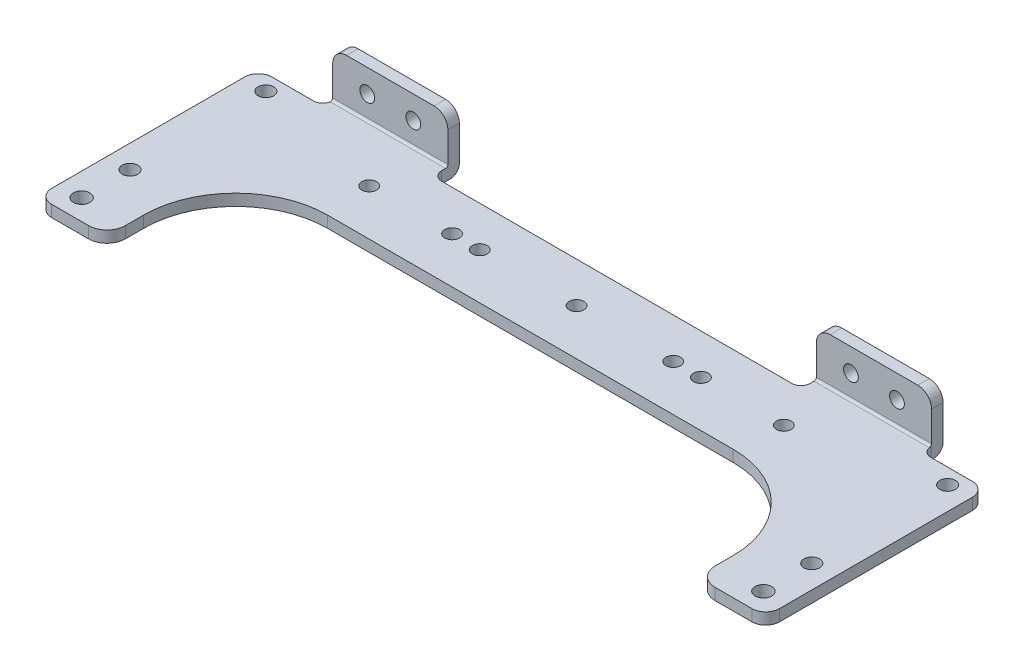
from build123d import *

# Parameters (mm, degrees)
SKETCH_1_W                      = 158
SKETCH_1_H                      = 47.848101266
EXTRUDE_1_DEPTH                 = 2.5
CUT_EXTRUDE_1_REACH             = 84.581
SKETCH_2_W                      = 64
SKETCH_2_H                      = 27.924050633
CUT_EXTRUDE_2_REACH             = 84.581
SKETCH_4_R                      = 1.7
SKETCH_4_R_2                    = 1.8
CUT_EXTRUDE_3_REACH             = 84.581
SKETCH_5_R                      = 1.6
CUT_EXTRUDE_3_DIRECTION_2_DEPTH = 83.580931205
FILLET_4_R                      = 3
FILLET_5_R                      = 4
FILLET_6_R                      = 20
EXTRUDE_START                   = -79
EXTRUDE_2_DEPTH                 = 65
CUT_EXTRUDE_START               = -79
CUT_EXTRUDE_4_DEPTH             = 40
FILLET_7_R                      = 0.5
FILLET_8_R                      = 2
FILLET_9_R                      = 3
FILLET_10_R                     = 2
SKETCH_10_R                     = 1.6
CUT_EXTRUDE_5_DEPTH             = 95.325235224
SKETCH_11_R                     = 1.6
CUT_EXTRUDE_6_DEPTH             = 85.602511087


with BuildPart() as part:
    # 草图1 → 凸台-拉伸1 (new body)
    with BuildSketch(Plane(origin=(0, 0, 0), x_dir=(1, 0, 0), z_dir=(0, 1, 0))):
        Rectangle(SKETCH_1_W, SKETCH_1_H)
    extrude(amount=EXTRUDE_1_DEPTH)

    # 草图2 → 切除-拉伸1 (cut, up to next)
    with BuildSketch(Plane(origin=(0, 2.5, 0), x_dir=(1, 0, 0), z_dir=(0, 1, 0)), mode=Mode.PRIVATE) as cut_extrude_1_sk1:
        with Locations((-32, -9.962025317)):
            Rectangle(SKETCH_2_W, SKETCH_2_H)
    cut_extrude_1_tool1 = extrude(cut_extrude_1_sk1.sketch, amount=-CUT_EXTRUDE_1_REACH, mode=Mode.PRIVATE) & part.part
    # 草图2 → 切除-拉伸1 (cut, up to next)
    with BuildSketch(Plane(origin=(0, 2.5, 0), x_dir=(1, 0, 0), z_dir=(0, 1, 0)), mode=Mode.PRIVATE) as cut_extrude_1_sk2:
        with Locations((32, -9.962025317)):
            Rectangle(SKETCH_2_W, SKETCH_2_H)
    cut_extrude_1_tool2 = extrude(cut_extrude_1_sk2.sketch, amount=-CUT_EXTRUDE_1_REACH, mode=Mode.PRIVATE) & part.part
    add(cut_extrude_1_tool1.solids().sort_by_distance((-32, 2.5, 9.962025))[0], mode=Mode.SUBTRACT)
    add(cut_extrude_1_tool2.solids().sort_by_distance((32, 2.5, 9.962025))[0], mode=Mode.SUBTRACT)

    # 草图4 → 切除-拉伸2 (cut, up to next)
    with BuildSketch(Plane(origin=(0, 2.5, 0), x_dir=(1, 0, 0), z_dir=(0, 1, 0)), mode=Mode.PRIVATE) as cut_extrude_2_sk1:
        with Locations(Location((-74, -8.924050633, 0), (0, 0, 270))):
            Circle(SKETCH_4_R)
    cut_extrude_2_tool1 = extrude(cut_extrude_2_sk1.sketch, amount=-CUT_EXTRUDE_2_REACH, mode=Mode.PRIVATE) & part.part
    # 草图4 → 切除-拉伸2 (cut, up to next)
    with BuildSketch(Plane(origin=(0, 2.5, 0), x_dir=(1, 0, 0), z_dir=(0, 1, 0)), mode=Mode.PRIVATE) as cut_extrude_2_sk2:
        with Locations(Location((-74, 20.575949367, 0), (0, 0, 270))):
            Circle(SKETCH_4_R)
    cut_extrude_2_tool2 = extrude(cut_extrude_2_sk2.sketch, amount=-CUT_EXTRUDE_2_REACH, mode=Mode.PRIVATE) & part.part
    # 草图4 → 切除-拉伸2 (cut, up to next)
    with BuildSketch(Plane(origin=(0, 2.5, 0), x_dir=(1, 0, 0), z_dir=(0, 1, 0)), mode=Mode.PRIVATE) as cut_extrude_2_sk3:
        with Locations(Location((-74, -19.424050633, 0), (0, 0, 270))):
            Circle(SKETCH_4_R_2)
    cut_extrude_2_tool3 = extrude(cut_extrude_2_sk3.sketch, amount=-CUT_EXTRUDE_2_REACH, mode=Mode.PRIVATE) & part.part
    # 草图4 → 切除-拉伸2 (cut, up to next)
    with BuildSketch(Plane(origin=(0, 2.5, 0), x_dir=(1, 0, 0), z_dir=(0, 1, 0)), mode=Mode.PRIVATE) as cut_extrude_2_sk4:
        with Locations(Location((74, 20.575949367, 0), (0, 0, 270))):
            Circle(SKETCH_4_R)
    cut_extrude_2_tool4 = extrude(cut_extrude_2_sk4.sketch, amount=-CUT_EXTRUDE_2_REACH, mode=Mode.PRIVATE) & part.part
    # 草图4 → 切除-拉伸2 (cut, up to next)
    with BuildSketch(Plane(origin=(0, 2.5, 0), x_dir=(1, 0, 0), z_dir=(0, 1, 0)), mode=Mode.PRIVATE) as cut_extrude_2_sk5:
        with Locations(Location((74, -19.424050633, 0), (0, 0, 270))):
            Circle(SKETCH_4_R_2)
    cut_extrude_2_tool5 = extrude(cut_extrude_2_sk5.sketch, amount=-CUT_EXTRUDE_2_REACH, mode=Mode.PRIVATE) & part.part
    # 草图4 → 切除-拉伸2 (cut, up to next)
    with BuildSketch(Plane(origin=(0, 2.5, 0), x_dir=(1, 0, 0), z_dir=(0, 1, 0)), mode=Mode.PRIVATE) as cut_extrude_2_sk6:
        with Locations(Location((74, -8.924050633, 0), (0, 0, 270))):
            Circle(SKETCH_4_R)
    cut_extrude_2_tool6 = extrude(cut_extrude_2_sk6.sketch, amount=-CUT_EXTRUDE_2_REACH, mode=Mode.PRIVATE) & part.part
    add(cut_extrude_2_tool1.solids().sort_by_distance((-74, 2.5, 8.924051))[0], mode=Mode.SUBTRACT)
    add(cut_extrude_2_tool2.solids().sort_by_distance((-74, 2.5, -20.575949))[0], mode=Mode.SUBTRACT)
    add(cut_extrude_2_tool3.solids().sort_by_distance((-74, 2.5, 19.424051))[0], mode=Mode.SUBTRACT)
    add(cut_extrude_2_tool4.solids().sort_by_distance((74, 2.5, -20.575949))[0], mode=Mode.SUBTRACT)
    add(cut_extrude_2_tool5.solids().sort_by_distance((74, 2.5, 19.424051))[0], mode=Mode.SUBTRACT)
    add(cut_extrude_2_tool6.solids().sort_by_distance((74, 2.5, 8.924051))[0], mode=Mode.SUBTRACT)

    # 草图5 → 切除-拉伸3 (cut, up to next)
    with BuildSketch(Plane(origin=(0, 2.5, 0), x_dir=(1, 0, 0), z_dir=(0, 1, 0)), mode=Mode.PRIVATE) as cut_extrude_3_sk1:
        with Locations(Location((0, 14, 0), (0, 0, 90))):
            Circle(SKETCH_5_R)
    cut_extrude_3_tool1 = extrude(cut_extrude_3_sk1.sketch, amount=-CUT_EXTRUDE_3_REACH, mode=Mode.PRIVATE) & part.part
    # 草图5 → 切除-拉伸3 (cut, up to next)
    with BuildSketch(Plane(origin=(0, 2.5, 0), x_dir=(1, 0, 0), z_dir=(0, 1, 0)), mode=Mode.PRIVATE) as cut_extrude_3_sk2:
        with Locations(Location((-45, 14, 0), (0, 0, 90))):
            Circle(SKETCH_5_R)
    cut_extrude_3_tool2 = extrude(cut_extrude_3_sk2.sketch, amount=-CUT_EXTRUDE_3_REACH, mode=Mode.PRIVATE) & part.part
    # 草图5 → 切除-拉伸3 (cut, up to next)
    with BuildSketch(Plane(origin=(0, 2.5, 0), x_dir=(1, 0, 0), z_dir=(0, 1, 0)), mode=Mode.PRIVATE) as cut_extrude_3_sk3:
        with Locations(Location((45, 14, 0), (0, 0, 90))):
            Circle(SKETCH_5_R)
    cut_extrude_3_tool3 = extrude(cut_extrude_3_sk3.sketch, amount=-CUT_EXTRUDE_3_REACH, mode=Mode.PRIVATE) & part.part
    add(cut_extrude_3_tool1.solids().sort_by_distance((0, 2.5, -14))[0], mode=Mode.SUBTRACT)
    add(cut_extrude_3_tool2.solids().sort_by_distance((-45, 2.5, -14))[0], mode=Mode.SUBTRACT)
    add(cut_extrude_3_tool3.solids().sort_by_distance((45, 2.5, -14))[0], mode=Mode.SUBTRACT)

    # 草图5 → 切除-拉伸3 direction 2 (cut)
    with BuildSketch(Plane(origin=(0, 2.5, 0), x_dir=(1, 0, 0), z_dir=(0, 1, 0))):
        with Locations(Location((0, 14, 0), (0, 0, 90))):
            Circle(SKETCH_5_R)
        with Locations(Location((-45, 14, 0), (0, 0, 90))):
            Circle(SKETCH_5_R)
        with Locations(Location((45, 14, 0), (0, 0, 90))):
            Circle(SKETCH_5_R)
    extrude(amount=CUT_EXTRUDE_3_DIRECTION_2_DEPTH, mode=Mode.SUBTRACT)

    # 圆角4
    fillet_4_edges = [part.edges().sort_by_distance(p)[0] for p in [
        (79, 1.25, 23.924050633),
        (-79, 1.25, 23.924050633),
        (-79, 1.25, -23.924050633),
        (79, 1.25, -23.924050633),
    ]]
    fillet(fillet_4_edges, radius=FILLET_4_R)

    # 圆角5
    fillet_5_edges = [part.edges().sort_by_distance(p)[0] for p in [
        (64, 1.25, 23.924050633),
        (-64, 1.25, 23.924050633),
    ]]
    fillet(fillet_5_edges, radius=FILLET_5_R)

    # 圆角6
    fillet_6_edges = [part.edges().sort_by_distance(p)[0] for p in [
        (-64, 1.25, -4),
        (64, 1.25, -4),
    ]]
    fillet(fillet_6_edges, radius=FILLET_6_R)

    # 草图8 → 凸台-拉伸2 (add, symmetric)
    with BuildSketch(Plane.ZY.offset(79).offset(EXTRUDE_START)):
        Polygon((-22.743286719, 0), (-28.575949367, 0), (-28.575949367, 12.5), (-26.075949367, 12.5), (-26.075949367, 2.5), (-22.743286719, 2.5), align=None)
    extrude(amount=EXTRUDE_2_DEPTH, both=True)

    # 草图9 → 切除-拉伸4 (cut, symmetric)
    with BuildSketch(Plane.ZY.offset(79).offset(CUT_EXTRUDE_START)):
        Polygon((-28.575949367, 0), (-22.743286719, 0), (-22.743286719, 2.5), (-26.075949367, 2.5), (-26.075949367, 12.5), (-28.575949367, 12.5), align=None)
    extrude(amount=CUT_EXTRUDE_4_DEPTH, both=True, mode=Mode.SUBTRACT)

    # 圆角7
    fillet_7_edges = [part.edges().sort_by_distance(p)[0] for p in [
        (52.5, 2.5, -26.075949367),
        (-52.5, 2.5, -26.075949367),
    ]]
    fillet(fillet_7_edges, radius=FILLET_7_R)

    # 圆角8
    fillet_8_edges = [part.edges().sort_by_distance(p)[0] for p in [
        (52.5, 0, -28.575949367),
        (-52.5, 0, -28.575949367),
    ]]
    fillet(fillet_8_edges, radius=FILLET_8_R)

    # 圆角9
    fillet_9_edges = [part.edges().sort_by_distance(p)[0] for p in [
        (-65, 12.5, -27.325949367),
        (65, 12.5, -27.325949367),
        (40, 12.5, -27.325949367),
        (-40, 12.5, -27.325949367),
    ]]
    fillet(fillet_9_edges, radius=FILLET_9_R)

    # 圆角10
    fillet_10_edges = [part.edges().sort_by_distance(p)[0] for p in [
        (-65, 1.25, -23.924050633),
        (-40, 1.25, -22.743286719),
        (65, 1.25, -23.924050633),
        (40, 1.25, -22.743286719),
    ]]
    fillet(fillet_10_edges, radius=FILLET_10_R)

    # 草图10 → 切除-拉伸5 (cut, through all)
    with BuildSketch(Plane.XY.offset(-26.075949367)):
        with Locations((-57.5, 7.5)):
            Circle(SKETCH_10_R)
        with Locations((-47.5, 7.5)):
            Circle(SKETCH_10_R)
        with Locations(Location((47.5, 7.5, 0), (0, 0, 180))):
            Circle(SKETCH_10_R)
        with Locations(Location((57.5, 7.5, 0), (0, 0, 180))):
            Circle(SKETCH_10_R)
    extrude(amount=-CUT_EXTRUDE_5_DEPTH, mode=Mode.SUBTRACT)

    # 草图11 → 切除-拉伸6 (cut, through all)
    with BuildSketch(Plane(origin=(0, 2.5, 0), x_dir=(1, 0, 0), z_dir=(0, 1, 0))):
        with Locations(Location((-27, 14, 0), (0, 0, 270))):
            Circle(SKETCH_11_R)
        with Locations(Location((-21, 14, 0), (0, 0, 270))):
            Circle(SKETCH_11_R)
        with Locations(Location((21, 14, 0), (0, 0, 90))):
            Circle(SKETCH_11_R)
        with Locations(Location((27, 14, 0), (0, 0, 90))):
            Circle(SKETCH_11_R)
    extrude(amount=-CUT_EXTRUDE_6_DEPTH, mode=Mode.SUBTRACT)


solid = part.part
